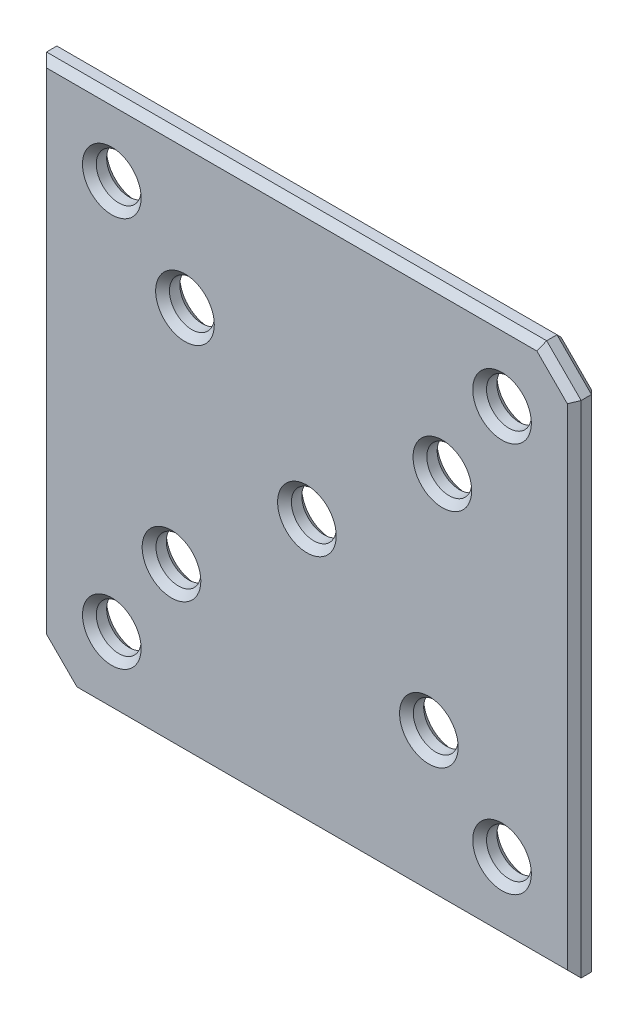
from build123d import *

# Parameters (mm, degrees)
SKETCH_1_R         = 13
EXTRUDE_1138_DEPTH = 14
CHAMFER_1_SIZE     = 4


with BuildPart() as part:
    # 草图1 → Extrude 1138 (new body)
    with BuildSketch(Plane.XY):
        Polygon((135, 155), (155, 135), (155, -155), (-135, -155), (-155, -135), (-155, 155), align=None)
        with Locations((-113.13708499, -113.13708499)):
            Circle(SKETCH_1_R, mode=Mode.SUBTRACT)
        with Locations((-78.524110604, -61.919012055)):
            Circle(SKETCH_1_R, mode=Mode.SUBTRACT)
        with Locations((78.524110604, 61.919012055)):
            Circle(SKETCH_1_R, mode=Mode.SUBTRACT)
        with Locations((113.13708499, 113.13708499)):
            Circle(SKETCH_1_R, mode=Mode.SUBTRACT)
        with Locations((-70.710678119, 70.710678119)):
            Circle(SKETCH_1_R, mode=Mode.SUBTRACT)
        with Locations((-113.13708499, 113.13708499)):
            Circle(SKETCH_1_R, mode=Mode.SUBTRACT)
        with Locations(Location((70.710678119, -70.710678119, 0), (0, 0, 180))):
            Circle(SKETCH_1_R, mode=Mode.SUBTRACT)
        with Locations(Location((113.13708499, -113.13708499, 0), (0, 0, 180))):
            Circle(SKETCH_1_R, mode=Mode.SUBTRACT)
        Circle(SKETCH_1_R, mode=Mode.SUBTRACT)
    extrude(amount=EXTRUDE_1138_DEPTH)

    # 倒角1
    chamfer_1_edges = [part.edges().sort_by_distance(p)[0] for p in [
        (10, -155, 14),
        (155, -10, 14),
        (145, 145, 14),
        (-126.13708499, -113.13708499, 0),
        (-126.13708499, -113.13708499, 14),
        (-10, 155, 14),
        (-91.524110604, -61.919012055, 0),
        (-91.524110604, -61.919012055, 14),
        (65.524110604, 61.919012055, 0),
        (65.524110604, 61.919012055, 14),
        (100.13708499, 113.13708499, 0),
        (100.13708499, 113.13708499, 14),
        (-83.710678119, 70.710678119, 0),
        (-83.710678119, 70.710678119, 14),
        (-126.13708499, 113.13708499, 0),
        (-126.13708499, 113.13708499, 14),
        (83.710678119, -70.710678119, 0),
        (83.710678119, -70.710678119, 14),
        (-155, 10, 14),
        (-13, 0, 0),
        (-13, 0, 14),
        (126.13708499, -113.13708499, 0),
        (126.13708499, -113.13708499, 14),
        (-10, 155, 0),
        (145, 145, 0),
        (155, -10, 0),
        (-145, -145, 14),
        (10, -155, 0),
        (-145, -145, 0),
        (-155, 10, 0),
    ]]
    chamfer(chamfer_1_edges, length=CHAMFER_1_SIZE)


solid = part.part
